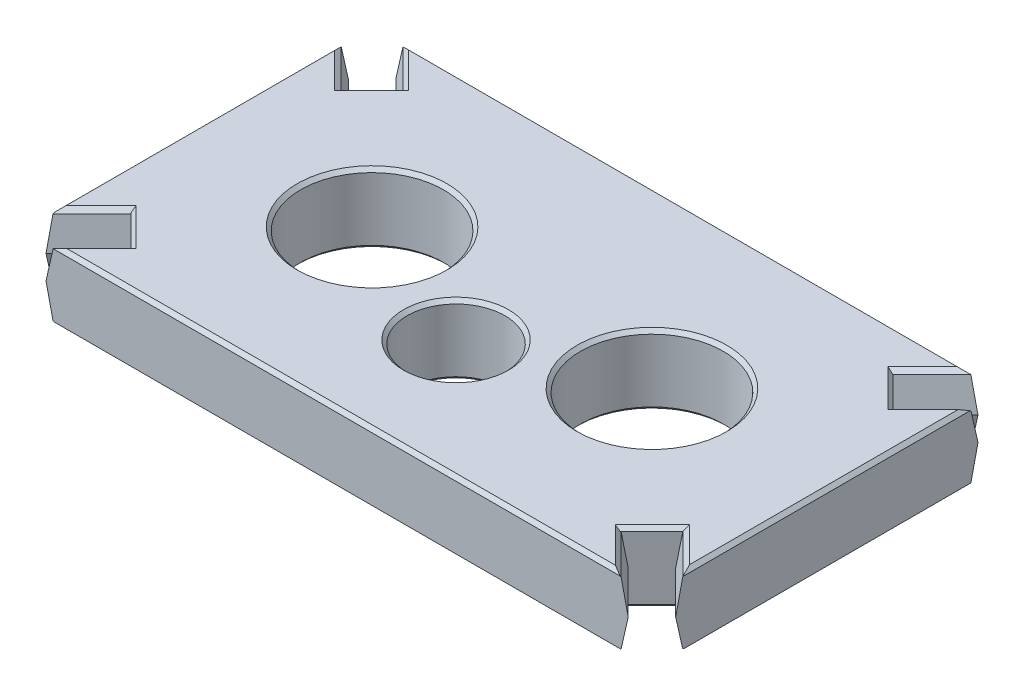
from build123d import *
from OCP.BRepFilletAPI import BRepFilletAPI_MakeChamfer

# Parameters (mm, degrees)
SKETCH1_W            = 45
SKETCH1_H            = 25
SKETCH1_R            = 5.1
SKETCH1_R_2          = 3.5
BOSS_EXTRUDE1_DEPTH  = 5
CUT_EXTRUDE3_DEPTH   = 5.5
MIRROR2_COPY_1_DEPTH = 5.5
CHAMFER1_SIZE        = 0.25
CHAMFER1_SIZE2       = 0.301404498


with BuildPart() as part:
    # Sketch1 → Boss-Extrude1 (new body)
    with BuildSketch(Plane(origin=(0, 0, 0), x_dir=(1, 0, 0), z_dir=(0, 1, 0))):
        Rectangle(SKETCH1_W, SKETCH1_H)
        with Locations(Location((-10, 0, 0), (0, 0, 270))):
            Circle(SKETCH1_R, mode=Mode.SUBTRACT)
        with Locations(Location((10, 0, 0), (0, 0, 270))):
            Circle(SKETCH1_R, mode=Mode.SUBTRACT)
        with Locations(Location((0, -4, 0), (0, 0, 270))):
            Circle(SKETCH1_R_2, mode=Mode.SUBTRACT)
    extrude(amount=BOSS_EXTRUDE1_DEPTH)

    # Sketch4 → Cut-Extrude3 (cut)
    with BuildSketch(Plane(origin=(-17.5, 0, -17.5), x_dir=(0, -1, 0), z_dir=(-0.7071067811865488, 0, -0.7071067811865464))):
        Polygon((-5, 8.671067812), (-5, 5.471067812), (-2.5, 5.871067812), (0, 5.471067812), (0, 8.671067812), (-2.5, 8.271067812), align=None)
    cut_extrude3 = extrude(amount=-CUT_EXTRUDE3_DEPTH, mode=Mode.SUBTRACT)

    # Mirror1: Cut-Extrude3 across plane
    add(cut_extrude3.mirror(Plane.XY), mode=Mode.SUBTRACT)

    # Mirror2: Cut-Extrude3 across plane
    add(cut_extrude3.mirror(Plane(origin=(0, 0, 0), x_dir=(0, 0, 1), z_dir=(1, 0, 0))), mode=Mode.SUBTRACT)

    # Mirror2 copy 1 sketch → Mirror2 copy 1 (cut)
    with BuildSketch(Plane(origin=(17.5, 0, 17.5), x_dir=(0, -1, 0), z_dir=(0.7071067811865488, 0, 0.7071067811865464))):
        Polygon((-5, 8.671067812), (-5, 5.471067812), (-2.5, 5.871067812), (0, 5.471067812), (0, 8.671067812), (-2.5, 8.271067812), align=None)
    extrude(amount=-MIRROR2_COPY_1_DEPTH, mode=Mode.SUBTRACT)

    # Chamfer1: one chamfer whose edges measure the first distance from different faces: ONE call of the kernel's chamfer builder (chamfer() names one face for all edges)
    chamfer1_edges_1 = [part.edges().sort_by_distance(p)[0] for p in [
        (22.5, 5, 0),
        (22.5, 0, 0),
        (18.610912703, 0, 8.610912703),
        (18.610912703, 5, 8.610912703),
        (-10, 0, -5.1),
        (-10, 5, -5.1),
        (10, 0, -5.1),
        (10, 5, -5.1),
        (0, 0, 0.5),
        (0, 5, 0.5),
        (-22.5, 0, 0),
        (-22.5, 5, 0),
        (-18.610912703, 0, -8.610912703),
        (-18.610912703, 5, -8.610912703),
        (0, 0, 12.5),
        (0, 5, 12.5),
        (-18.610912703, 5, 8.610912703),
        (-18.610912703, 0, 8.610912703),
        (0, 0, -12.5),
        (0, 5, -12.5),
        (18.610912703, 5, -8.610912703),
        (18.610912703, 0, -8.610912703),
    ]]
    chamfer1_edges_2 = [part.edges().sort_by_distance(p)[0] for p in [
        (21.121141777, 5, 8.858400077),
    ]]
    chamfer1_side_2 = [part.faces().sort_by_distance(p)[0] for p in [
        (21.049281331, 3.729674797, 9.073981413),
    ]]
    chamfer1_edges_3 = [part.edges().sort_by_distance(p)[0] for p in [
        (21.121141777, 0, 8.858400077),
        (-21.121141777, 0, -8.858400077),
        (-18.858400077, 0, 11.121141777),
        (18.858400077, 0, -11.121141777),
    ]]
    chamfer1_side_3 = [part.faces().sort_by_distance(p)[0] for p in [
        (0, 0, -0.178389984),
    ]]
    chamfer1_edges_4 = [part.edges().sort_by_distance(p)[0] for p in [
        (18.858400077, 0, 11.121141777),
    ]]
    chamfer1_side_4 = [part.faces().sort_by_distance(p)[0] for p in [
        (19.073981413, 1.270325203, 11.049281331),
    ]]
    chamfer1_edges_5 = [part.edges().sort_by_distance(p)[0] for p in [
        (18.858400077, 5, 11.121141777),
        (-18.858400077, 5, -11.121141777),
        (-21.121141777, 5, 8.858400077),
        (21.121141777, 5, -8.858400077),
    ]]
    chamfer1_side_5 = [part.faces().sort_by_distance(p)[0] for p in [
        (0, 5, -0.178389984),
    ]]
    chamfer1_edges_6 = [part.edges().sort_by_distance(p)[0] for p in [
        (-21.121141777, 5, -8.858400077),
    ]]
    chamfer1_side_6 = [part.faces().sort_by_distance(p)[0] for p in [
        (-21.049281331, 3.729674797, -9.073981413),
    ]]
    chamfer1_edges_7 = [part.edges().sort_by_distance(p)[0] for p in [
        (-18.858400077, 0, -11.121141777),
    ]]
    chamfer1_side_7 = [part.faces().sort_by_distance(p)[0] for p in [
        (-19.073981413, 1.270325203, -11.049281331),
    ]]
    chamfer1_edges_8 = [part.edges().sort_by_distance(p)[0] for p in [
        (-21.121141777, 0, 8.858400077),
    ]]
    chamfer1_side_8 = [part.faces().sort_by_distance(p)[0] for p in [
        (-21.049281331, 1.270325203, 9.073981413),
    ]]
    chamfer1_edges_9 = [part.edges().sort_by_distance(p)[0] for p in [
        (-18.858400077, 5, 11.121141777),
    ]]
    chamfer1_side_9 = [part.faces().sort_by_distance(p)[0] for p in [
        (-19.073981413, 3.729674797, 11.049281331),
    ]]
    chamfer1_edges_10 = [part.edges().sort_by_distance(p)[0] for p in [
        (21.121141777, 0, -8.858400077),
    ]]
    chamfer1_side_10 = [part.faces().sort_by_distance(p)[0] for p in [
        (21.049281331, 1.270325203, -9.073981413),
    ]]
    chamfer1_edges_11 = [part.edges().sort_by_distance(p)[0] for p in [
        (18.858400077, 5, -11.121141777),
    ]]
    chamfer1_side_11 = [part.faces().sort_by_distance(p)[0] for p in [
        (19.073981413, 3.729674797, -11.049281331),
    ]]
    chamfer1 = BRepFilletAPI_MakeChamfer(part.part.solid().wrapped)
    for e in chamfer1_edges_1:
        chamfer1.Add(CHAMFER1_SIZE, e.wrapped)
    for e in chamfer1_edges_2:
        chamfer1.Add(CHAMFER1_SIZE, CHAMFER1_SIZE2, e.wrapped, chamfer1_side_2[0].wrapped)  # the first distance lies on this face
    for e in chamfer1_edges_3:
        chamfer1.Add(CHAMFER1_SIZE, CHAMFER1_SIZE2, e.wrapped, chamfer1_side_3[0].wrapped)  # the first distance lies on this face
    for e in chamfer1_edges_4:
        chamfer1.Add(CHAMFER1_SIZE, CHAMFER1_SIZE2, e.wrapped, chamfer1_side_4[0].wrapped)  # the first distance lies on this face
    for e in chamfer1_edges_5:
        chamfer1.Add(CHAMFER1_SIZE, CHAMFER1_SIZE2, e.wrapped, chamfer1_side_5[0].wrapped)  # the first distance lies on this face
    for e in chamfer1_edges_6:
        chamfer1.Add(CHAMFER1_SIZE, CHAMFER1_SIZE2, e.wrapped, chamfer1_side_6[0].wrapped)  # the first distance lies on this face
    for e in chamfer1_edges_7:
        chamfer1.Add(CHAMFER1_SIZE, CHAMFER1_SIZE2, e.wrapped, chamfer1_side_7[0].wrapped)  # the first distance lies on this face
    for e in chamfer1_edges_8:
        chamfer1.Add(CHAMFER1_SIZE, CHAMFER1_SIZE2, e.wrapped, chamfer1_side_8[0].wrapped)  # the first distance lies on this face
    for e in chamfer1_edges_9:
        chamfer1.Add(CHAMFER1_SIZE, CHAMFER1_SIZE2, e.wrapped, chamfer1_side_9[0].wrapped)  # the first distance lies on this face
    for e in chamfer1_edges_10:
        chamfer1.Add(CHAMFER1_SIZE, CHAMFER1_SIZE2, e.wrapped, chamfer1_side_10[0].wrapped)  # the first distance lies on this face
    for e in chamfer1_edges_11:
        chamfer1.Add(CHAMFER1_SIZE, CHAMFER1_SIZE2, e.wrapped, chamfer1_side_11[0].wrapped)  # the first distance lies on this face
    add(Compound.cast(chamfer1.Shape()), mode=Mode.REPLACE)


solid = part.part
